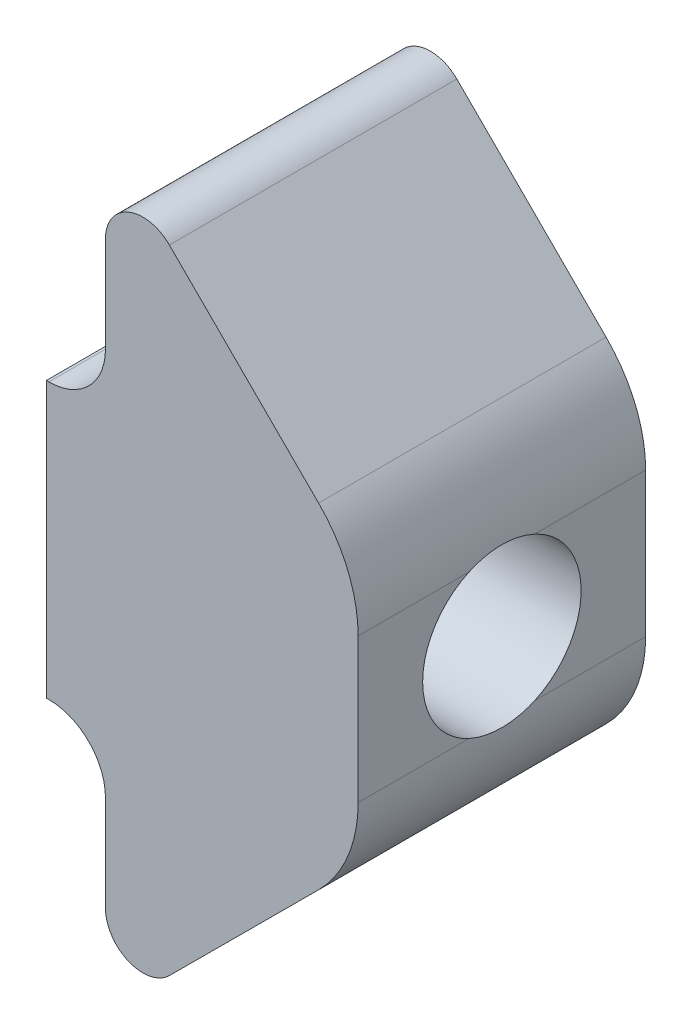
from build123d import *

# Parameters (mm, degrees)
BOSS_EXTRUDE1_DEPTH = 6.35
CUT_EXTRUDE1_REACH  = 13.833
SKETCH2_R           = 1.75
FILLET1_R           = 0.2


with BuildPart() as part:
    # Sketch1 → Boss-Extrude1 (new body)
    with BuildSketch(Plane.XY):
        with BuildLine():
            Line((-11.5951, -3.038456882), (-11.5951, 3.038456882))
            Line((-11.5951, 3.038456882), (-11.539212407, 3.038456882))
            ThreePointArc((-11.539212407, 3.038456882), (-10.656027264, 3.404284146), (-10.2902, 4.287469289))
            Line((-10.2902, 4.287469289), (-10.2902, 6.402089023))
            ThreePointArc((-10.2902, 6.402089023), (-9.779862704, 7.166335846), (-8.878390822, 6.987825881))
            Line((-8.878390822, 6.987825881), (-5.582265308, 3.69923341))
            ThreePointArc((-5.582265308, 3.69923341), (-4.935610063, 2.733240723), (-4.7085, 1.593185507))
            Line((-4.7085, 1.593185507), (-4.7085, -1.593185507))
            ThreePointArc((-4.7085, -1.593185507), (-4.935610063, -2.733240723), (-5.582265308, -3.69923341))
            Line((-5.582265308, -3.69923341), (-8.878390822, -6.987825881))
            ThreePointArc((-8.878390822, -6.987825881), (-9.779862704, -7.166335846), (-10.2902, -6.402089023))
            Line((-10.2902, -6.402089023), (-10.2902, -4.287469289))
            ThreePointArc((-10.2902, -4.287469289), (-10.656027264, -3.404284146), (-11.539212407, -3.038456882))
            Line((-11.539212407, -3.038456882), (-11.5951, -3.038456882))
        make_face()
    extrude(amount=BOSS_EXTRUDE1_DEPTH)

    # Sketch2 → Cut-Extrude1 (cut, up to next)
    with BuildSketch(Plane.ZY.offset(11.5951), mode=Mode.PRIVATE) as cut_extrude1_sk1:
        with Locations((3.175, 0)):
            Circle(SKETCH2_R)
    cut_extrude1_tool1 = extrude(cut_extrude1_sk1.sketch, amount=-CUT_EXTRUDE1_REACH, mode=Mode.PRIVATE) & part.part
    add(cut_extrude1_tool1.solids().sort_by_distance((-11.5951, 0, 3.175))[0], mode=Mode.SUBTRACT)

    # Fillet1
    fillet1_edges = [part.edges().sort_by_distance(p)[0] for p in [
        (-11.5951, 0, 1.425),
    ]]
    fillet(fillet1_edges, radius=FILLET1_R)


solid = part.part
